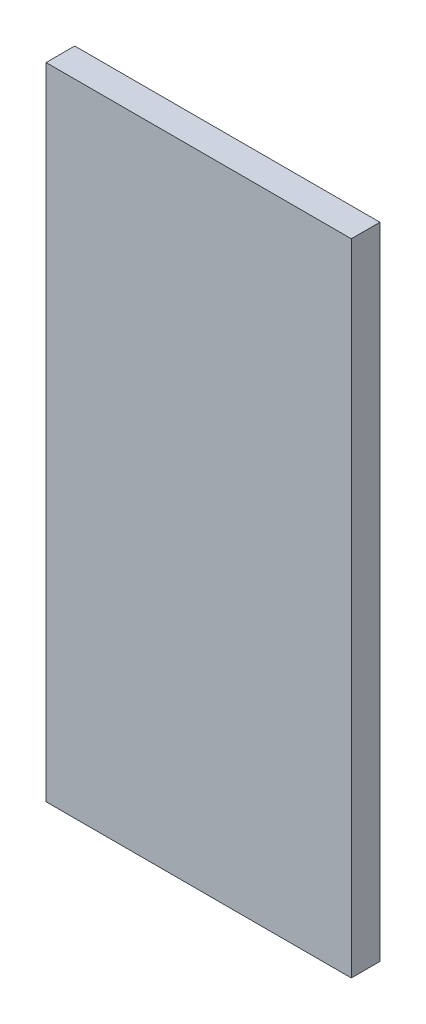
from build123d import *

# Parameters (mm, degrees)
SKETCH1_W           = 203.2
SKETCH1_H           = 426.212
BOSS_EXTRUDE1_DEPTH = 19.05


with BuildPart() as part:
    # Sketch1 → Boss-Extrude1 (new body)
    with BuildSketch(Plane.XY):
        with Locations((54.173231441, -113.097379343)):
            Rectangle(SKETCH1_W, SKETCH1_H)
    extrude(amount=BOSS_EXTRUDE1_DEPTH)


solid = part.part
